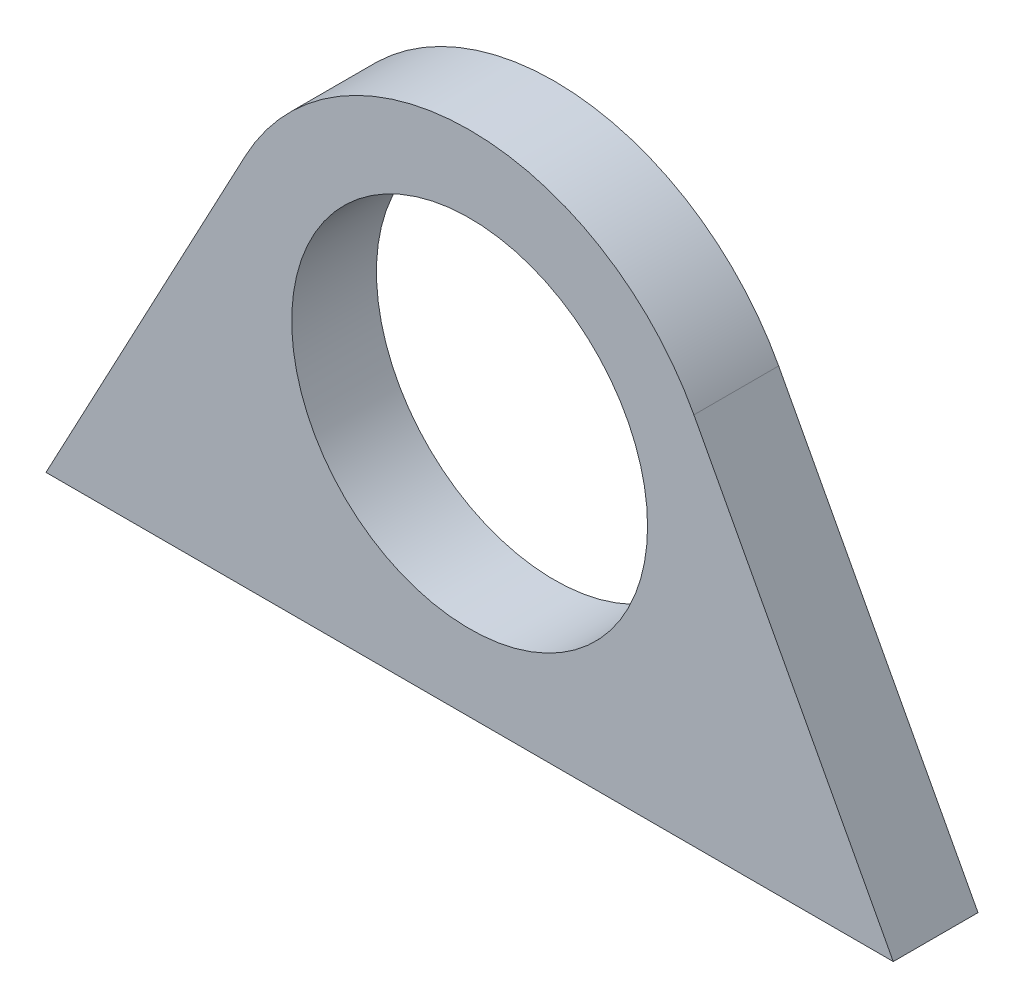
from build123d import *

# Parameters (mm, degrees)
SKETCH1_R           = 10.5
BOSS_EXTRUDE1_DEPTH = 5


with BuildPart() as part:
    # Sketch1 → Boss-Extrude1 (new body)
    with BuildSketch(Plane.XY):
        with BuildLine():
            Line((-25, -15), (25, -15))
            Line((25, -15), (13.235294118, 7.058823529))
            ThreePointArc((13.235294118, 7.058823529), (0, 15), (-13.235294118, 7.058823529))
            Line((-13.235294118, 7.058823529), (-25, -15))
        make_face()
        Circle(SKETCH1_R, mode=Mode.SUBTRACT)
    extrude(amount=BOSS_EXTRUDE1_DEPTH)


solid = part.part
